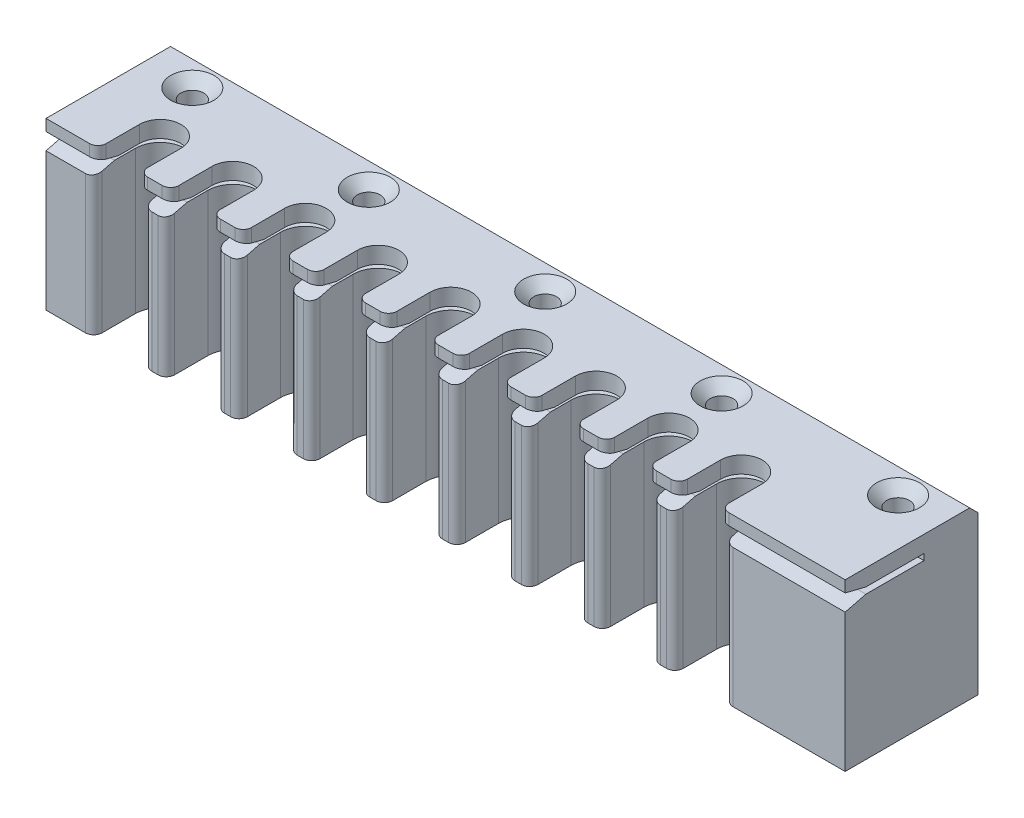
from build123d import *

# Parameters (mm, degrees)
SKETCH_1_W                         = 192.5
SKETCH_1_H                         = 32
EXTRUDE_286_DEPTH                  = 34.5
SKETCH_4_W                         = 192.5
SKETCH_4_H                         = 13
EXTRUDE_1152_DEPTH                 = 1.5
CUT_EXTRUDE_1403_DEPTH             = 104.490639673
SKETCH_5_W                         = 192.5
SKETCH_5_H                         = 32
EXTRUDE_1554_DEPTH                 = 4
CUT_EXTRUDE_1876_DEPTH             = 198.261881771
CUT_EXTRUDE_2071_REACH             = 107.452
CUT_EXTRUDE_2071_DIRECTION_2_DEPTH = 106.451706956
FILLET_1_R                         = 2
PATTERN_LINEAR_1_COUNT             = 9
PATTERN_LINEAR_1_PITCH             = 17.5
FILLET_1_OF_PATTERN_LINEAR_1_R     = 2
HOLE_WIZARD_M5_D                   = 5.5
HOLE_WIZARD_M5_CSINK_D             = 10.4
HOLE_WIZARD_M5_CSINK_ANGLE         = 90
CHAMFER_1_SIZE                     = 2


with BuildPart() as part:
    # Эскиз1 → Extrude 286 (new body)
    with BuildSketch(Plane(origin=(0, 0, 0), x_dir=(1, 0, 0), z_dir=(0, 1, 0))):
        Rectangle(SKETCH_1_W, SKETCH_1_H)
    extrude(amount=EXTRUDE_286_DEPTH)

    # Эскиз4 → Extrude 1152 (add)
    with BuildSketch(Plane(origin=(0, 34.5, 0), x_dir=(1, 0, 0), z_dir=(0, 1, 0))):
        with Locations((0, 9.5)):
            Rectangle(SKETCH_4_W, SKETCH_4_H)
    extrude(amount=EXTRUDE_1152_DEPTH)

    # Эскиз2 → Cut-Extrude 1403 (cut, through all)
    with BuildSketch(Plane(origin=(0, 34.5, 0), x_dir=(1, 0, 0), z_dir=(0, 1, 0))):
        with BuildLine():
            Line((-84.75, -16), (-84.75, -6))
            ThreePointArc((-84.75, -6), (-78.75, 0), (-72.75, -6))
            Line((-72.75, -6), (-72.75, -16))
            Line((-72.75, -16), (-84.75, -16))
        make_face()
    cut_extrude_1403 = extrude(amount=-CUT_EXTRUDE_1403_DEPTH, mode=Mode.SUBTRACT)

    # Эскиз5 → Extrude 1554 (add)
    with BuildSketch(Plane(origin=(0, 36, 0), x_dir=(1, 0, 0), z_dir=(0, 1, 0))):
        Rectangle(SKETCH_5_W, SKETCH_5_H)
    extrude(amount=EXTRUDE_1554_DEPTH)

    # Эскиз3 → Cut-Extrude 1876 (cut, through all)
    with BuildSketch(Plane.ZY.offset(96.25)):
        Polygon((16, 33.25), (11, 34.5), (11, 36), (16, 37.25), align=None)
    extrude(amount=-CUT_EXTRUDE_1876_DEPTH, mode=Mode.SUBTRACT)

    # Эскиз7 → Cut-Extrude 2071 (cut, up to next)
    with BuildSketch(Plane(origin=(0, 40, 0), x_dir=(1, 0, 0), z_dir=(0, 1, 0)), mode=Mode.PRIVATE) as cut_extrude_2071_sk1:
        with BuildLine():
            Line((-83.75, -6), (-83.75, -16))
            Line((-83.75, -16), (-73.75, -16))
            Line((-73.75, -16), (-73.75, -6))
            ThreePointArc((-73.75, -6), (-78.75, -1), (-83.75, -6))
        make_face()
    cut_extrude_2071_tool1 = extrude(cut_extrude_2071_sk1.sketch, amount=-CUT_EXTRUDE_2071_REACH, mode=Mode.PRIVATE) & part.part
    cut_extrude_2071 = cut_extrude_2071_tool1.solids().sort_by_distance((-78.75, 40, 8.991792))[0]
    add(cut_extrude_2071, mode=Mode.SUBTRACT)

    # Эскиз7 → Cut-Extrude 2071 direction 2 (cut)
    with BuildSketch(Plane(origin=(0, 40, 0), x_dir=(1, 0, 0), z_dir=(0, 1, 0))):
        with BuildLine():
            Line((-83.75, -6), (-83.75, -16))
            Line((-83.75, -16), (-73.75, -16))
            Line((-73.75, -16), (-73.75, -6))
            ThreePointArc((-73.75, -6), (-78.75, -1), (-83.75, -6))
        make_face()
    cut_extrude_2071_direction_2 = extrude(amount=CUT_EXTRUDE_2071_DIRECTION_2_DEPTH, mode=Mode.SUBTRACT)

    # Скругление1
    fillet_1_edges = [part.edges().sort_by_distance(p)[0] for p in [
        (-72.75, 16.625, 16),
        (-84.75, 16.625, 16),
        (-83.75, 38.625, 16),
        (-73.75, 38.625, 16),
    ]]
    fillet(fillet_1_edges, radius=FILLET_1_R)

    # Линейный массив1: Cut-Extrude 1403, Cut-Extrude 2071, Cut-Extrude 2071 direction 2 ×9
    with Locations(*[(i * PATTERN_LINEAR_1_PITCH, 0, 0) for i in range(1, PATTERN_LINEAR_1_COUNT)]):
        add(cut_extrude_1403, mode=Mode.SUBTRACT)
        add(cut_extrude_2071, mode=Mode.SUBTRACT)
        add(cut_extrude_2071_direction_2, mode=Mode.SUBTRACT)

    # Скругление1 of Линейный массив1
    fillet_1_of_pattern_linear_1_edges = [part.edges().sort_by_distance(p)[0] for p in [
        (-55.25, 16.625, 16),
        (-67.25, 16.625, 16),
        (-66.25, 38.625, 16),
        (-56.25, 38.625, 16),
        (-37.75, 16.625, 16),
        (-49.75, 16.625, 16),
        (-48.75, 38.625, 16),
        (-38.75, 38.625, 16),
        (-20.25, 16.625, 16),
        (-32.25, 16.625, 16),
        (-31.25, 38.625, 16),
        (-21.25, 38.625, 16),
        (-2.75, 16.625, 16),
        (-14.75, 16.625, 16),
        (-13.75, 38.625, 16),
        (-3.75, 38.625, 16),
        (14.75, 16.625, 16),
        (2.75, 16.625, 16),
        (3.75, 38.625, 16),
        (13.75, 38.625, 16),
        (32.25, 16.625, 16),
        (20.25, 16.625, 16),
        (21.25, 38.625, 16),
        (31.25, 38.625, 16),
        (49.75, 16.625, 16),
        (37.75, 16.625, 16),
        (38.75, 38.625, 16),
        (48.75, 38.625, 16),
        (67.25, 16.625, 16),
        (55.25, 16.625, 16),
        (56.25, 38.625, 16),
        (66.25, 38.625, 16),
    ]]
    fillet(fillet_1_of_pattern_linear_1_edges, radius=FILLET_1_OF_PATTERN_LINEAR_1_R)

    # Крепление - M5 (through all)
    with Locations(Plane(origin=(0, 40, 0), x_dir=(1, 0, 0), z_dir=(0, 1, 0))):
        with Locations((-85, 8), (0, 8), (85, 8), (42.5, 8), (-42.5, 8)):
            CounterSinkHole(HOLE_WIZARD_M5_D / 2, HOLE_WIZARD_M5_CSINK_D / 2, counter_sink_angle=HOLE_WIZARD_M5_CSINK_ANGLE)

    # Фаска1
    chamfer_1_edges = [part.edges().sort_by_distance(p)[0] for p in [
        (0, 40, -16),
    ]]
    chamfer(chamfer_1_edges, length=CHAMFER_1_SIZE)


solid = part.part
